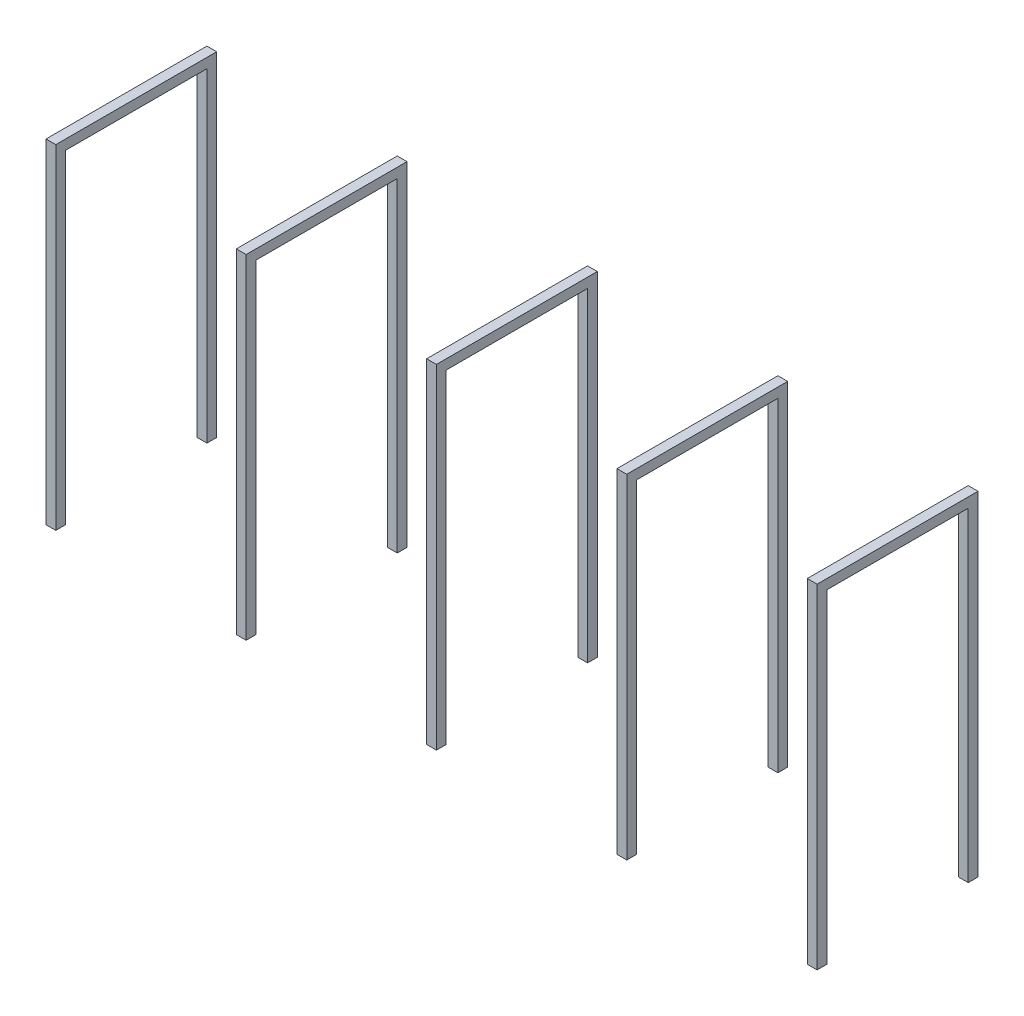
from build123d import *

# Parameters (mm, degrees)
CROQUIS1_W                 = 76.2
CROQUIS1_H                 = 76.2
SALIENTE_EXTRUIR1_DEPTH    = 2600
SALIENTE_EXTRUIR1_2_DEPTH  = 2600
SALIENTE_EXTRUIR1_3_DEPTH  = 2600
SALIENTE_EXTRUIR1_4_DEPTH  = 2600
SALIENTE_EXTRUIR1_5_DEPTH  = 2600
SALIENTE_EXTRUIR1_6_DEPTH  = 2600
SALIENTE_EXTRUIR1_7_DEPTH  = 2600
SALIENTE_EXTRUIR1_8_DEPTH  = 2600
SALIENTE_EXTRUIR1_9_DEPTH  = 2600
SALIENTE_EXTRUIR1_10_DEPTH = 2600
CROQUIS2_W                 = 76.2
CROQUIS2_H                 = 76.2
SALIENTE_EXTRUIR2_DEPTH    = 1100


with BuildPart() as part:
    # Croquis1 → Saliente-Extruir1 (new body)
    with BuildSketch(Plane(origin=(0, 0, 0), x_dir=(1, 0, 0), z_dir=(0, 1, 0))):
        with Locations((38.1, -38.1)):
            Rectangle(CROQUIS1_W, CROQUIS1_H)
    extrude(amount=SALIENTE_EXTRUIR1_DEPTH)



with BuildPart() as body_2:
    # Croquis1 → Saliente-Extruir1 2 (new body)
    with BuildSketch(Plane(origin=(0, 0, 0), x_dir=(1, 0, 0), z_dir=(0, 1, 0))):
        with Locations((1519.3, -38.1)):
            Rectangle(CROQUIS1_W, CROQUIS1_H)
    extrude(amount=SALIENTE_EXTRUIR1_2_DEPTH)


with BuildPart() as body_3:
    # Croquis1 → Saliente-Extruir1 3 (new body)
    with BuildSketch(Plane(origin=(0, 0, 0), x_dir=(1, 0, 0), z_dir=(0, 1, 0))):
        with Locations((3000.5, -38.1)):
            Rectangle(CROQUIS1_W, CROQUIS1_H)
    extrude(amount=SALIENTE_EXTRUIR1_3_DEPTH)


with BuildPart() as body_4:
    # Croquis1 → Saliente-Extruir1 4 (new body)
    with BuildSketch(Plane(origin=(0, 0, 0), x_dir=(1, 0, 0), z_dir=(0, 1, 0))):
        with Locations((4481.7, -38.1)):
            Rectangle(CROQUIS1_W, CROQUIS1_H)
    extrude(amount=SALIENTE_EXTRUIR1_4_DEPTH)


with BuildPart() as body_5:
    # Croquis1 → Saliente-Extruir1 5 (new body)
    with BuildSketch(Plane(origin=(0, 0, 0), x_dir=(1, 0, 0), z_dir=(0, 1, 0))):
        with Locations((5962.9, -38.1)):
            Rectangle(CROQUIS1_W, CROQUIS1_H)
    extrude(amount=SALIENTE_EXTRUIR1_5_DEPTH)


with BuildPart() as body_6:
    # Croquis1 → Saliente-Extruir1 6 (new body)
    with BuildSketch(Plane(origin=(0, 0, 0), x_dir=(1, 0, 0), z_dir=(0, 1, 0))):
        with Locations((5962.9, -1214.3)):
            Rectangle(CROQUIS1_W, CROQUIS1_H)
    extrude(amount=SALIENTE_EXTRUIR1_6_DEPTH)


with BuildPart() as body_7:
    # Croquis1 → Saliente-Extruir1 7 (new body)
    with BuildSketch(Plane(origin=(0, 0, 0), x_dir=(1, 0, 0), z_dir=(0, 1, 0))):
        with Locations((4481.7, -1214.3)):
            Rectangle(CROQUIS1_W, CROQUIS1_H)
    extrude(amount=SALIENTE_EXTRUIR1_7_DEPTH)


with BuildPart() as body_8:
    # Croquis1 → Saliente-Extruir1 8 (new body)
    with BuildSketch(Plane(origin=(0, 0, 0), x_dir=(1, 0, 0), z_dir=(0, 1, 0))):
        with Locations((3000.5, -1214.3)):
            Rectangle(CROQUIS1_W, CROQUIS1_H)
    extrude(amount=SALIENTE_EXTRUIR1_8_DEPTH)


with BuildPart() as body_9:
    # Croquis1 → Saliente-Extruir1 9 (new body)
    with BuildSketch(Plane(origin=(0, 0, 0), x_dir=(1, 0, 0), z_dir=(0, 1, 0))):
        with Locations((1519.3, -1214.3)):
            Rectangle(CROQUIS1_W, CROQUIS1_H)
    extrude(amount=SALIENTE_EXTRUIR1_9_DEPTH)


with BuildPart() as body_10:
    # Croquis1 → Saliente-Extruir1 10 (new body)
    with BuildSketch(Plane(origin=(0, 0, 0), x_dir=(1, 0, 0), z_dir=(0, 1, 0))):
        with Locations((38.1, -1214.3)):
            Rectangle(CROQUIS1_W, CROQUIS1_H)
    extrude(amount=SALIENTE_EXTRUIR1_10_DEPTH)


with BuildPart() as part_1:
    add(part.part)

    add(body_2.part)  # Saliente-Extruir2 merges body 2

    add(body_3.part)  # Saliente-Extruir2 merges body 3

    add(body_4.part)  # Saliente-Extruir2 merges body 4

    add(body_5.part)  # Saliente-Extruir2 merges body 5

    add(body_6.part)  # Saliente-Extruir2 merges body 6

    add(body_7.part)  # Saliente-Extruir2 merges body 7

    add(body_8.part)  # Saliente-Extruir2 merges body 8

    add(body_9.part)  # Saliente-Extruir2 merges body 9

    add(body_10.part)  # Saliente-Extruir2 merges body 10
    # Croquis2 → Saliente-Extruir2 (add)
    with BuildSketch(Plane.XY.offset(76.2)):
        with Locations((38.1, 2561.9)):
            Rectangle(CROQUIS2_W, CROQUIS2_H)
        with Locations((1519.3, 2561.9)):
            Rectangle(CROQUIS2_W, CROQUIS2_H)
        with Locations((3000.5, 2561.9)):
            Rectangle(CROQUIS2_W, CROQUIS2_H)
        with Locations((4481.7, 2561.9)):
            Rectangle(CROQUIS2_W, CROQUIS2_H)
        with Locations((5962.9, 2561.9)):
            Rectangle(CROQUIS2_W, CROQUIS2_H)
    extrude(amount=SALIENTE_EXTRUIR2_DEPTH)


solid = part_1.part
